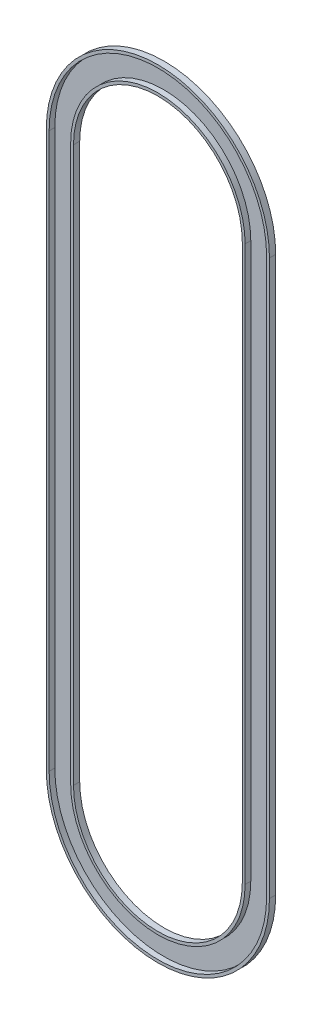
from build123d import *

# Parameters (mm, degrees)
BOSS_EXTRUDE1_DEPTH = 5
BOSS_EXTRUDE2_DEPTH = 50
BOSS_EXTRUDE3_DEPTH = 50


with BuildPart() as part:
    # Sketch1 → Boss-Extrude1 (new body)
    with BuildSketch(Plane.XY):
        with BuildLine():
            Line((-985, 5402.168929815), (-985, 505.168929815))
            ThreePointArc((-985, 505.168929815), (0, -479.831070185), (985, 505.168929815))
            Line((985, 505.168929815), (985, 5402.168929815))
            ThreePointArc((985, 5402.168929815), (0, 6387.168929815), (-985, 5402.168929815))
        make_face()
        with BuildLine():
            Line((-745, 5402.168929815), (-745, 505.168929815))
            ThreePointArc((-745, 505.168929815), (0, -239.831070185), (745, 505.168929815))
            Line((745, 505.168929815), (745, 5402.168929815))
            ThreePointArc((745, 5402.168929815), (0, 6147.168929815), (-745, 5402.168929815))
        make_face(mode=Mode.SUBTRACT)
    extrude(amount=BOSS_EXTRUDE1_DEPTH)

    # Sketch2 → Boss-Extrude2 (add)
    with BuildSketch(Plane.XY.offset(5)):
        with BuildLine():
            Line((-770, 5402.168929815), (-770, 505.168929815))
            ThreePointArc((-770, 505.168929815), (0, -264.831070185), (770, 505.168929815))
            Line((770, 505.168929815), (770, 5402.168929815))
            ThreePointArc((770, 5402.168929815), (0, 6172.168929815), (-770, 5402.168929815))
        make_face()
        with BuildLine():
            Line((745, 505.168929815), (745, 5402.168929815))
            ThreePointArc((745, 5402.168929815), (0, 6147.168929815), (-745, 5402.168929815))
            Line((-745, 5402.168929815), (-745, 505.168929815))
            ThreePointArc((-745, 505.168929815), (0, -239.831070185), (745, 505.168929815))
        make_face(mode=Mode.SUBTRACT)
    extrude(amount=BOSS_EXTRUDE2_DEPTH)

    # Sketch3 → Boss-Extrude3 (add)
    with BuildSketch(Plane.XY.offset(5)):
        with BuildLine():
            Line((985, 505.168929815), (985, 5402.168929815))
            ThreePointArc((985, 5402.168929815), (0, 6387.168929815), (-985, 5402.168929815))
            Line((-985, 5402.168929815), (-985, 505.168929815))
            ThreePointArc((-985, 505.168929815), (0, -479.831070185), (985, 505.168929815))
        make_face()
        with BuildLine():
            Line((-960, 5402.168929815), (-960, 505.168929815))
            ThreePointArc((-960, 505.168929815), (0, -454.831070185), (960, 505.168929815))
            Line((960, 505.168929815), (960, 5402.168929815))
            ThreePointArc((960, 5402.168929815), (0, 6362.168929815), (-960, 5402.168929815))
        make_face(mode=Mode.SUBTRACT)
    extrude(amount=BOSS_EXTRUDE3_DEPTH)


solid = part.part
